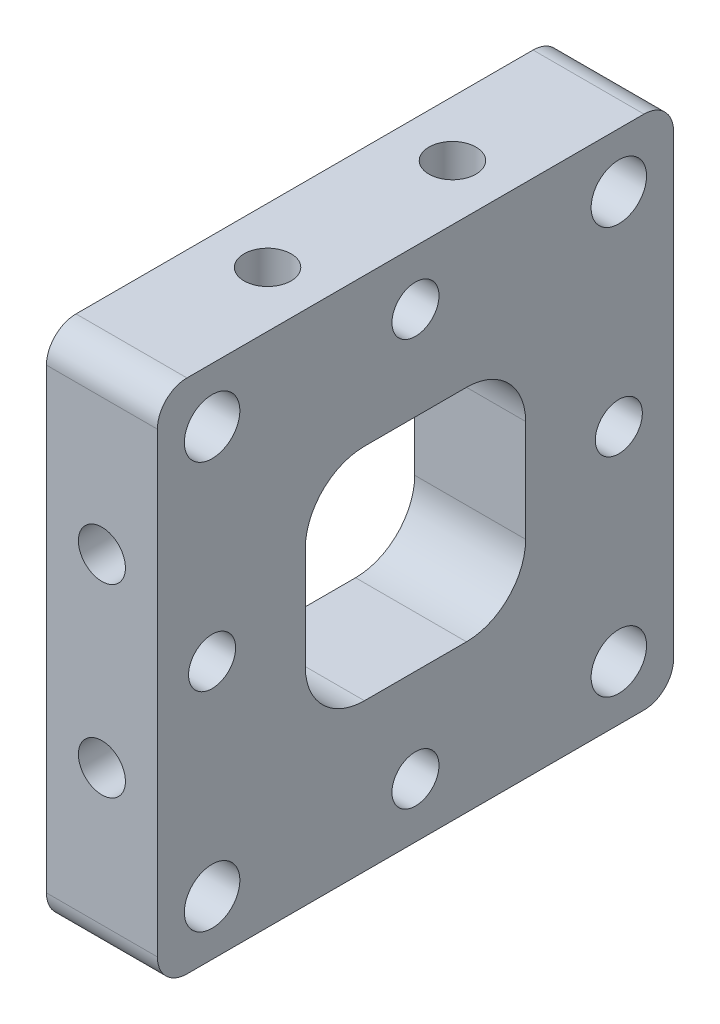
from build123d import *

# Parameters (mm, degrees)
SKETCH1_W                       = 44.323
SKETCH1_H                       = 44.323
SKETCH1_R                       = 2.38125
BOSS_EXTRUDE1_DEPTH             = 4.7625
FILLET1_R                       = 2.54
F_10_32_TAPPED_HOLE1_D          = 4.0386
F_10_32_TAPPED_HOLE1_DEPTH      = 12.0396
F_10_32_TAPPED_HOLE1_TIP        = 1.213317848
F_10_32_TAPPED_HOLE2_AT_2_COUNT = 2
F_10_32_TAPPED_HOLE2_AT_2_PITCH = 15.875
CIRPATTERN1_COUNT               = 4
F_10_32_TAPPED_HOLE3_D          = 4.0386
F_10_32_TAPPED_HOLE3_DEPTH      = 9.525
F_10_32_TAPPED_HOLE3_TIP        = 1.213317848
SKETCH19_W                      = 18.923
SKETCH19_H                      = 18.923
CUT_EXTRUDE1_DEPTH              = 33.756522854
FILLET2_R                       = 5.08


with BuildPart() as part:
    # Sketch1 → Boss-Extrude1 (new, symmetric)
    with BuildSketch(Plane(origin=(0, 0, 0), x_dir=(0, 0, -1), z_dir=(1, 0, 0))):
        Rectangle(SKETCH1_W, SKETCH1_H)
        with Locations((-17.4625, 17.4625)):
            Circle(SKETCH1_R, mode=Mode.SUBTRACT)
        with Locations((17.4625, 17.4625)):
            Circle(SKETCH1_R, mode=Mode.SUBTRACT)
        with Locations((-17.4625, -17.4625)):
            Circle(SKETCH1_R, mode=Mode.SUBTRACT)
        with Locations((17.4625, -17.4625)):
            Circle(SKETCH1_R, mode=Mode.SUBTRACT)
    extrude(amount=BOSS_EXTRUDE1_DEPTH, both=True)

    # Fillet1
    fillet1_edges = [part.edges().sort_by_distance(p)[0] for p in [
        (0, -22.1615, -22.1615),
        (0, -22.1615, 22.1615),
        (0, 22.1615, 22.1615),
        (0, 22.1615, -22.1615),
    ]]
    fillet(fillet1_edges, radius=FILLET1_R)

    # #10-32 Tapped Hole1
    with Locations(Plane.ZY.offset(4.7625)):
        with Locations((0, -17.4625), (0, 17.4625), (-17.4625, 0), (17.4625, 0)):
            Hole(F_10_32_TAPPED_HOLE1_D / 2, depth=F_10_32_TAPPED_HOLE1_DEPTH)
            with Locations((0, 0, -(F_10_32_TAPPED_HOLE1_DEPTH + F_10_32_TAPPED_HOLE1_TIP / 2))):  # 118° drill point
                Cone(0, F_10_32_TAPPED_HOLE1_D / 2, F_10_32_TAPPED_HOLE1_TIP, mode=Mode.SUBTRACT)

    # Sketch15 → #10-32 Tapped Hole2 (revolve, cut)
    with BuildSketch(Plane(origin=(0, 22.1615, -7.9375), x_dir=(0, 0, 1), z_dir=(1, 0, 0))):
        Polygon((0, 0), (0, 10.738317848), (2.0193, 9.525), (2.0193, 0), align=None)
    f_10_32_tapped_hole2 = revolve(axis=Axis((0, 28.5115, -7.9375), (0, -1, 0)), mode=Mode.SUBTRACT)

    # #10-32 Tapped Hole2 at 2: #10-32 Tapped Hole2 ×2
    with Locations(*[(0, 0, i * F_10_32_TAPPED_HOLE2_AT_2_PITCH) for i in range(1, F_10_32_TAPPED_HOLE2_AT_2_COUNT)]):
        add(f_10_32_tapped_hole2, mode=Mode.SUBTRACT)

    # CirPattern1: #10-32 Tapped Hole2 ×4 about axis, 1 skipped
    cirpattern1_axis = Axis((0, 0, 0), (1, 0, 0))
    add([f_10_32_tapped_hole2.rotate(cirpattern1_axis, i * 360 / CIRPATTERN1_COUNT) for i in range(1, CIRPATTERN1_COUNT) if i not in (2,)], mode=Mode.SUBTRACT)

    # CirPattern1 copy 1 sketch → CirPattern1 copy 1 (revolve, cut)
    with BuildSketch(Plane(origin=(0, -7.9375, 22.1615), x_dir=(0, -1, 0), z_dir=(1, 0, 0))):
        Polygon((0, 0), (0, 10.738317848), (2.0193, 9.525), (2.0193, 0), align=None)
    revolve(axis=Axis((0, -7.9375, 28.5115), (0, 0, -1)), mode=Mode.SUBTRACT)

    # CirPattern1 copy 2 sketch → CirPattern1 copy 2 (revolve, cut)
    with BuildSketch(Plane(origin=(0, 7.9375, -22.1615), x_dir=(0, 1, 0), z_dir=(1, 0, 0))):
        Polygon((0, 0), (0, 10.738317848), (2.0193, 9.525), (2.0193, 0), align=None)
    revolve(axis=Axis((0, 7.9375, -28.5115), (0, 0, 1)), mode=Mode.SUBTRACT)

    # #10-32 Tapped Hole3
    with Locations(Plane(origin=(0, -22.1615, 0), x_dir=(-1, 0, 0), z_dir=(0, -1, 0))):
        with Locations((0, -11.1125), (0, 11.1125)):
            Hole(F_10_32_TAPPED_HOLE3_D / 2, depth=F_10_32_TAPPED_HOLE3_DEPTH)
            with Locations((0, 0, -(F_10_32_TAPPED_HOLE3_DEPTH + F_10_32_TAPPED_HOLE3_TIP / 2))):  # 118° drill point
                Cone(0, F_10_32_TAPPED_HOLE3_D / 2, F_10_32_TAPPED_HOLE3_TIP, mode=Mode.SUBTRACT)

    # Sketch19 → Cut-Extrude1 (cut, through all)
    with BuildSketch(Plane(origin=(4.7625, 0, 0), x_dir=(0, 0, -1), z_dir=(1, 0, 0))):
        Rectangle(SKETCH19_W, SKETCH19_H)
    extrude(amount=-CUT_EXTRUDE1_DEPTH, mode=Mode.SUBTRACT)

    # Fillet2
    fillet2_edges = [part.edges().sort_by_distance(p)[0] for p in [
        (0, 9.4615, -9.4615),
        (0, -9.4615, -9.4615),
        (0, -9.4615, 9.4615),
        (0, 9.4615, 9.4615),
    ]]
    fillet(fillet2_edges, radius=FILLET2_R)


solid = part.part
